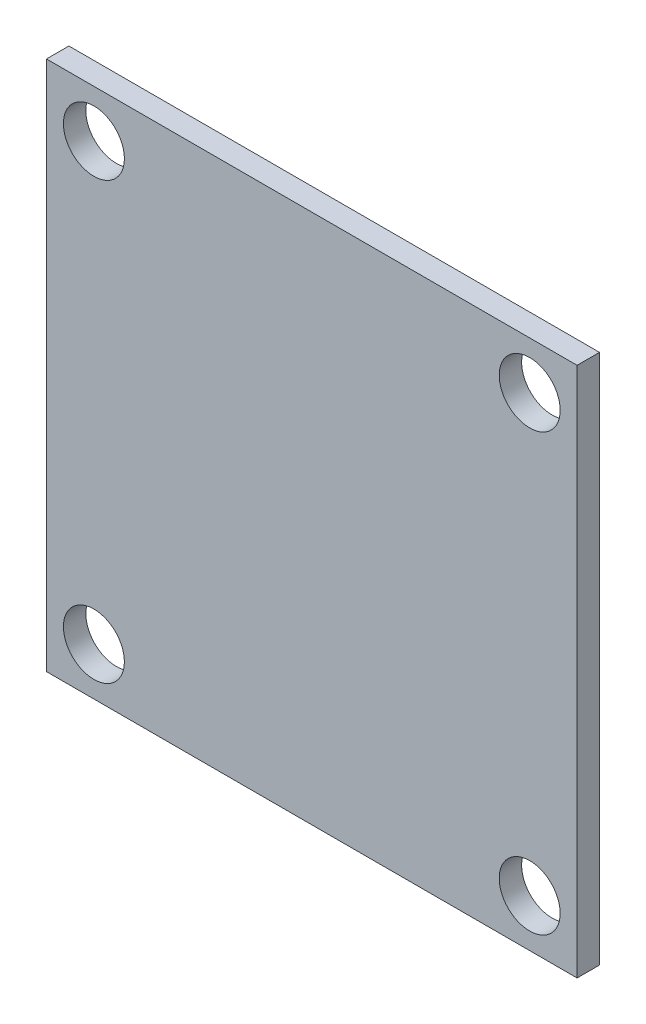
from build123d import *

# Parameters (mm, degrees)
SKETCH1_W             = 28.4
SKETCH1_H             = 28.4
BOSS_EXTRUDE1_DEPTH   = 1.2
F_4_CLEARANCE_HOLE1_D = 3.2639


with BuildPart() as part:
    # Sketch1 → Boss-Extrude1 (new body)
    with BuildSketch(Plane.XY):
        Rectangle(SKETCH1_W, SKETCH1_H)
    extrude(amount=BOSS_EXTRUDE1_DEPTH)

    # #4 Clearance Hole1 (through all)
    with Locations(Plane.XY.offset(1.2)):
        with Locations((-11.6625, 11.66), (11.6625, 11.66), (-11.6625, -11.66), (11.6625, -11.66)):
            Hole(F_4_CLEARANCE_HOLE1_D / 2)


solid = part.part
